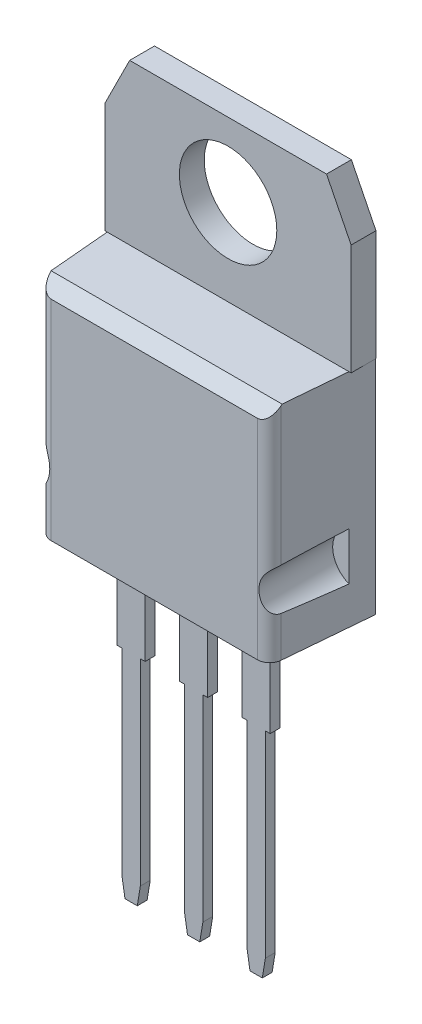
from build123d import *

# Parameters (mm, degrees)
SKETCH2_W                = 10
SKETCH2_H                = 9
BOSS_EXTRUDE1_DEPTH      = 4
CHAMFER1_SIZE            = 0.5
CUT_EXTRUDE1_DEPTH       = 3
BOSS_EXTRUDE2_DEPTH      = 0.4
LPATTERN1_COUNT          = 2
LPATTERN1_PITCH          = 2.54
LPATTERN2_COUNT          = 2
LPATTERN2_PITCH          = 2.54
DRAFT2_ANGLE             = -5
BOSS_EXTRUDE3_DEPTH      = 0.01
BOSS_EXTRUDE3_DEPTH_BACK = 1
SKETCH8_R                = 1.98
FILLET1_R                = 0.5
SCALE1_SCALE             = 0.6


with BuildPart() as part:
    # Sketch2 → Boss-Extrude1 (new body)
    with BuildSketch(Plane.XY):
        Rectangle(SKETCH2_W, SKETCH2_H)
    extrude(amount=BOSS_EXTRUDE1_DEPTH)

    # Chamfer1
    chamfer1_edges = [part.edges().sort_by_distance(p)[0] for p in [
        (0, 4.5, 4),
    ]]
    chamfer(chamfer1_edges, length=CHAMFER1_SIZE)

    # Sketch6 → Cut-Extrude1 (cut)
    with BuildSketch(Plane.XY.offset(4)):
        with BuildLine():
            Line((5, -1), (5, -3))
            ThreePointArc((5, -3), (4.25, -2), (5, -1))
        make_face()
    cut_extrude1 = extrude(amount=-CUT_EXTRUDE1_DEPTH, mode=Mode.SUBTRACT)

    # Mirror1: Cut-Extrude1 across plane
    add(cut_extrude1.mirror(Plane(origin=(0, 0, 0), x_dir=(0, 0, 1), z_dir=(1, 0, 0))), mode=Mode.SUBTRACT)

    # Sketch7 → Boss-Extrude2 (add)
    with BuildSketch(Plane.XY.offset(2)):
        Polygon((-0.57, -4.5), (-0.57, -8.44), (-0.375, -8.44), (-0.375, -16.44), (-0.25, -17.2), (0.25, -17.2), (0.375, -16.44), (0.375, -8.44), (0.57, -8.44), (0.57, -4.5), align=None)
    boss_extrude2 = extrude(amount=BOSS_EXTRUDE2_DEPTH)

    # LPattern1: Boss-Extrude2 ×2
    with Locations(*[(-i * LPATTERN1_PITCH, 0, 0) for i in range(1, LPATTERN1_COUNT)]):
        add(boss_extrude2)

    # LPattern2: Boss-Extrude2 ×2
    with Locations(*[(i * LPATTERN2_PITCH, 0, 0) for i in range(1, LPATTERN2_COUNT)]):
        add(boss_extrude2)

    # Draft2
    draft2_faces = [part.faces().sort_by_distance(p)[0] for p in [
        (5, 0.383542538, 1.891910739),
        (-5, 0.383542538, 1.891910739),
    ]]
    draft(draft2_faces, Plane(origin=(0, 0, 0), x_dir=(-1, 0, 0), z_dir=(0, 0, -1)), DRAFT2_ANGLE)

    # Sketch8 → Boss-Extrude3 (add, two sides: drawn at the far end of the back side and taken through both)
    with BuildSketch(Plane(origin=(0, 0, 0), x_dir=(-1, 0, 0), z_dir=(0, 0, -1)).offset(-BOSS_EXTRUDE3_DEPTH_BACK)):
        Polygon((-5, 9), (-4, 11), (4, 11), (5, 9), (5, 4.5), (-5, 4.5), align=None)
        with Locations(Location((0, 8, 0), (0, 0, 180))):
            Circle(SKETCH8_R, mode=Mode.SUBTRACT)
    extrude(amount=BOSS_EXTRUDE3_DEPTH + BOSS_EXTRUDE3_DEPTH_BACK)

    # Fillet1
    fillet1_edges = [part.edges().sort_by_distance(p)[0] for p in [
        (-4.650045346, 1.410302183, 4),
        (4.650045346, 1.410302183, 4),
    ]]
    fillet(fillet1_edges, radius=FILLET1_R)


with BuildPart() as part_1:
    # Scale1: scaled about (0, 0, 0)
    add(part.part.scale(SCALE1_SCALE))


solid = part_1.part
